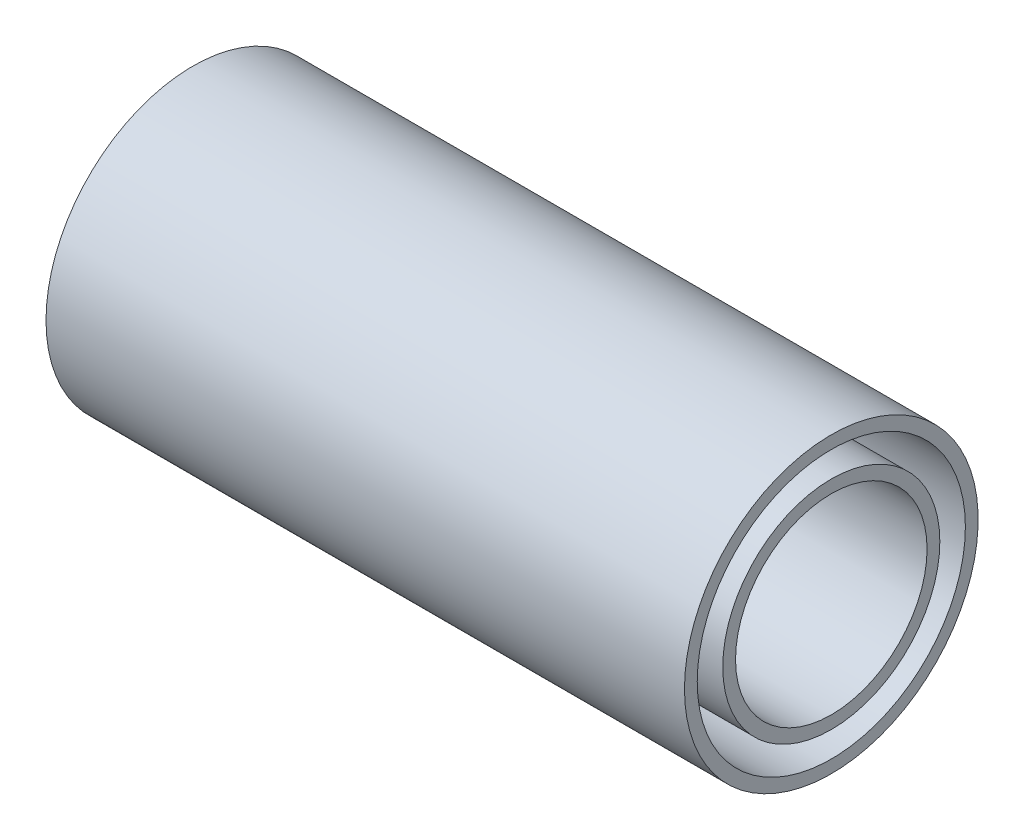
from build123d import *

# Parameters (mm, degrees)
SKETCH1_W = 127
SKETCH1_H = 2.54


with BuildPart() as part:
    # Sketch1 → Revolve1 (revolve)
    with BuildSketch(Plane.XY, mode=Mode.PRIVATE) as revolve1_sk:
        with Locations((63.5, 20.32)):
            Rectangle(SKETCH1_W, SKETCH1_H)
        with Locations((63.5, 27.94)):
            Rectangle(SKETCH1_W, SKETCH1_H)
    revolve(revolve1_sk.sketch.rotate(Axis((0, 0, 0), (1, 0, 0)), 90), axis=Axis((0, 0, 0), (1, 0, 0)))


solid = part.part
